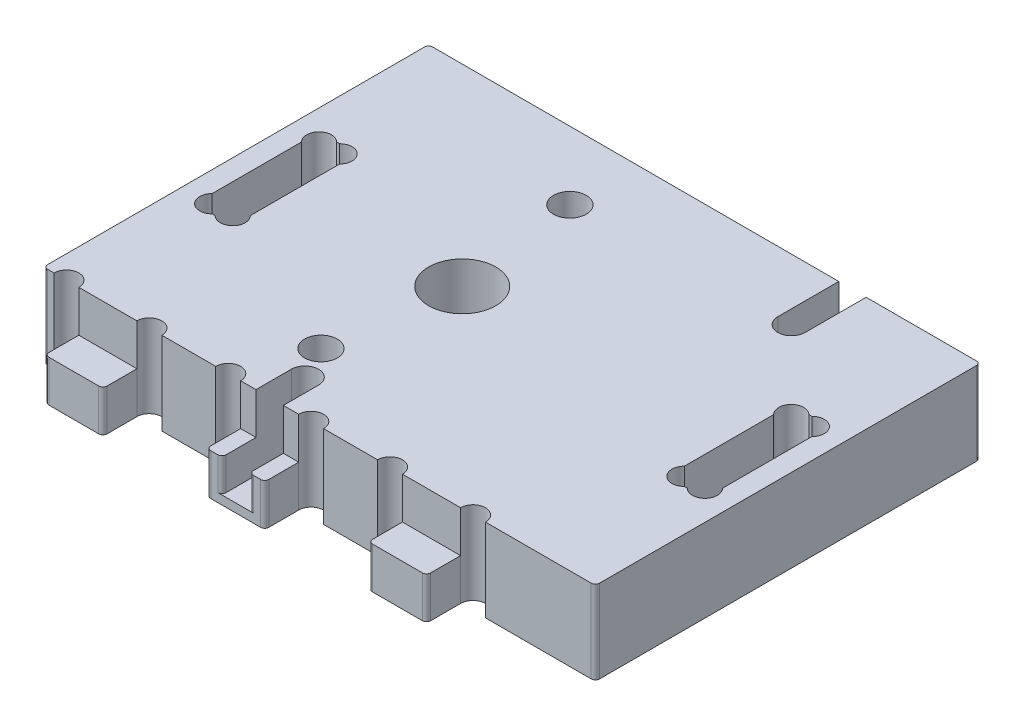
from build123d import *

# Parameters (mm, degrees)
BOSS_EXTRUDE1_DEPTH = 10
SKETCH2_R           = 4.05
SKETCH2_R_2         = 1.975
CUT_EXTRUDE1_DEPTH  = 49.845189118
SKETCH14_W          = 50.25
SKETCH14_H          = 4.1
CUT_EXTRUDE13_DEPTH = 5
SKETCH16_W          = 4.6
SKETCH16_H          = 15
CUT_EXTRUDE15_DEPTH = 10
CUT_EXTRUDE14_DEPTH = 49.845189118
SKETCH19_W          = 7
SKETCH19_H          = 5
BOSS_EXTRUDE2_DEPTH = 1
CUT_EXTRUDE16_DEPTH = 8.95
FILLET1_R           = 0.5


with BuildPart() as part:
    # Sketch1 → Boss-Extrude1 (new body)
    with BuildSketch(Plane(origin=(0, 0, 0), x_dir=(1, 0, 0), z_dir=(0, 1, 0))):
        Polygon((-23, 23.2), (23, 23.2), (39.25, 23.2), (39.25, -23.2), (23, -23.2), (23, -27.3), (16, -27.3), (16, -23.2), (3.5, -23.2), (3.5, -27.3), (-3.5, -27.3), (-3.5, -23.2), (-16, -23.2), (-16, -27.3), (-23, -27.3), (-23, -23.2), (-27.25, -23.2), (-27.25, 23.2), align=None)
    extrude(amount=BOSS_EXTRUDE1_DEPTH)

    # Sketch2 → Cut-Extrude1 (cut, through all)
    with BuildSketch(Plane(origin=(0, 10, 0), x_dir=(1, 0, 0), z_dir=(0, 1, 0))):
        with Locations(Location((0, 0, 0), (0, 0, 270))):
            Circle(SKETCH2_R)
        with Locations(Location((-2.025, 15, 0), (0, 0, 270))):
            Circle(SKETCH2_R_2)
        with Locations(Location((-2.025, -15, 0), (0, 0, 270))):
            Circle(SKETCH2_R_2)
    extrude(amount=-CUT_EXTRUDE1_DEPTH, mode=Mode.SUBTRACT)

    # Sketch14 → Cut-Extrude13 (cut)
    with BuildSketch(Plane(origin=(0, 10, 0), x_dir=(1, 0, 0), z_dir=(0, 1, 0))):
        with Locations((-2.125, -25.25)):
            Rectangle(SKETCH14_W, SKETCH14_H)
    extrude(amount=-CUT_EXTRUDE13_DEPTH, mode=Mode.SUBTRACT)

    # Sketch16 → Cut-Extrude15 (cut)
    with BuildSketch(Plane.XZ):
        with Locations((34.45, 0)):
            Rectangle(SKETCH16_W, SKETCH16_H)
        with Locations((-22.45, 0)):
            Rectangle(SKETCH16_W, SKETCH16_H)
    extrude(amount=-CUT_EXTRUDE15_DEPTH, mode=Mode.SUBTRACT)

    # Sketch15 → Cut-Extrude14 (cut, through all)
    with BuildSketch(Plane(origin=(0, 10, 0), x_dir=(1, 0, 0), z_dir=(0, 1, 0))):
        with BuildLine():
            Line((13, -27.3), (13, -23.2))
            ThreePointArc((13, -23.2), (14.5, -21.7), (16, -23.2))
            Line((16, -23.2), (16, -27.3))
            ThreePointArc((16, -27.3), (14.5, -28.8), (13, -27.3))
        make_face()
        with BuildLine():
            Line((3.5, -27.3), (3.5, -23.2))
            ThreePointArc((3.5, -23.2), (5, -21.7), (6.5, -23.2))
            Line((6.5, -23.2), (6.5, -27.3))
            ThreePointArc((6.5, -27.3), (5, -28.8), (3.5, -27.3))
        make_face()
        with BuildLine():
            Line((-13, -27.3), (-13, -23.2))
            ThreePointArc((-13, -23.2), (-14.5, -21.7), (-16, -23.2))
            Line((-16, -23.2), (-16, -27.3))
            ThreePointArc((-16, -27.3), (-14.5, -28.8), (-13, -27.3))
        make_face()
        with BuildLine():
            Line((-3.5, -27.3), (-3.5, -23.2))
            ThreePointArc((-3.5, -23.2), (-5, -21.7), (-6.5, -23.2))
            Line((-6.5, -23.2), (-6.5, -27.3))
            ThreePointArc((-6.5, -27.3), (-5, -28.8), (-3.5, -27.3))
        make_face()
        with BuildLine():
            Line((23, -27.3), (23, -23.2))
            ThreePointArc((23, -23.2), (24.5, -21.7), (26, -23.2))
            Line((26, -23.2), (26, -27.3))
            ThreePointArc((26, -27.3), (24.5, -28.8), (23, -27.3))
        make_face()
        with BuildLine():
            Line((-23, -27.3), (-23, -23.2))
            ThreePointArc((-23, -23.2), (-24.5, -21.7), (-26, -23.2))
            Line((-26, -23.2), (-26, -27.3))
            ThreePointArc((-26, -27.3), (-24.5, -28.8), (-23, -27.3))
        make_face()
        with BuildLine():
            ThreePointArc((34.45, 7.284346805), (31.710660172, 6.439339828), (34.45, 5.594332852))
            ThreePointArc((34.45, 5.594332852), (37.189339828, 6.439339828), (34.45, 7.284346805))
        make_face()
        with BuildLine():
            ThreePointArc((34.45, -7.284346805), (31.710660172, -6.439339828), (34.45, -5.594332852))
            ThreePointArc((34.45, -5.594332852), (37.189339828, -6.439339828), (34.45, -7.284346805))
        make_face()
        with BuildLine():
            ThreePointArc((-22.45, -7.284346805), (-19.710660172, -6.439339828), (-22.45, -5.594332852))
            ThreePointArc((-22.45, -5.594332852), (-25.189339828, -6.439339828), (-22.45, -7.284346805))
        make_face()
        with BuildLine():
            ThreePointArc((-22.45, 7.284346805), (-25.189339828, 6.439339828), (-22.45, 5.594332852))
            ThreePointArc((-22.45, 5.594332852), (-19.710660172, 6.439339828), (-22.45, 7.284346805))
        make_face()
    extrude(amount=-CUT_EXTRUDE14_DEPTH, mode=Mode.SUBTRACT)

    # Sketch19 → Boss-Extrude2 (add)
    with BuildSketch(Plane(origin=(0, 0, -23.2), x_dir=(-1, 0, 0), z_dir=(0, 0, -1))):
        with Locations((-23.83, 2.5)):
            Rectangle(SKETCH19_W, SKETCH19_H)
    extrude(amount=BOSS_EXTRUDE2_DEPTH)

    # Sketch17 → Cut-Extrude16 (cut)
    with BuildSketch(Plane(origin=(0, 10, 0), x_dir=(1, 0, 0), z_dir=(0, 1, 0))):
        with BuildLine():
            Line((25.48, 24.2), (25.48, 15.85))
            ThreePointArc((25.48, 15.85), (23.83, 14.2), (22.18, 15.85))
            Line((22.18, 15.85), (22.18, 24.2))
            ThreePointArc((22.18, 24.2), (23.83, 25.85), (25.48, 24.2))
        make_face()
        with BuildLine():
            Line((1.65, -18.95), (1.65, -27.3))
            ThreePointArc((1.65, -27.3), (0, -28.95), (-1.65, -27.3))
            Line((-1.65, -27.3), (-1.65, -18.95))
            ThreePointArc((-1.65, -18.95), (0, -17.3), (1.65, -18.95))
        make_face()
    extrude(amount=-CUT_EXTRUDE16_DEPTH, mode=Mode.SUBTRACT)

    # Fillet1
    fillet1_edges = [part.edges().sort_by_distance(p)[0] for p in [
        (-27.25, 5, 23.2),
        (-27.25, 5, -23.2),
        (39.25, 5, -23.2),
        (39.25, 5, 23.2),
        (20.33, 2.5, -24.2),
        (27.33, 2.5, -24.2),
        (25.48, 3.025, -24.2),
        (22.18, 3.025, -24.2),
        (-1.65, 3.025, 27.3),
        (1.65, 3.025, 27.3),
        (-16, 2.5, 27.3),
        (-23, 2.5, 27.3),
        (23, 2.5, 27.3),
        (16, 2.5, 27.3),
        (3.5, 2.5, 27.3),
        (-3.5, 2.5, 27.3),
    ]]
    fillet(fillet1_edges, radius=FILLET1_R)


solid = part.part
